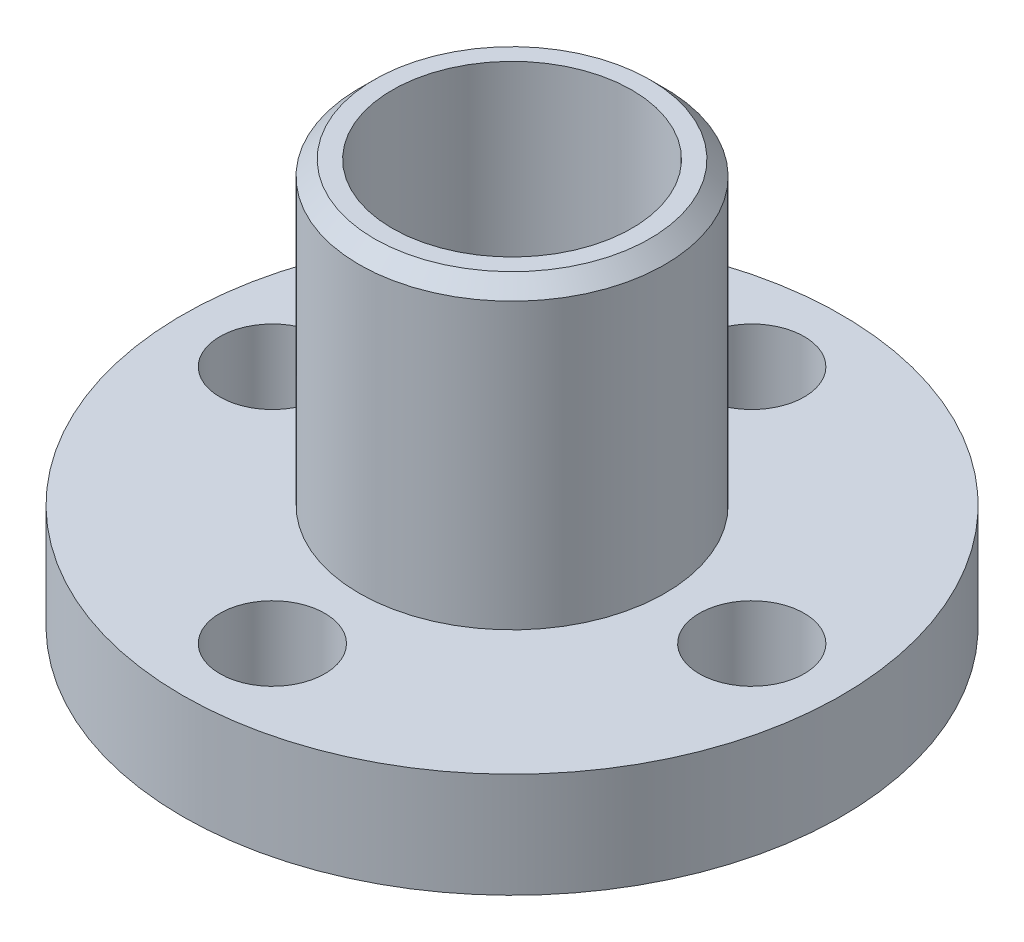
from build123d import *

# Parameters (mm, degrees)
SKETCH_1_R          = 11
EXTRUDE_1_DEPTH     = 3.5
SKETCH_2_R          = 4
CUT_EXTRUDE_1_DEPTH = 16.945218719
EXTRUDE_START       = 10
SKETCH_3_R          = 5.1
SKETCH_3_R_2        = 4
EXTRUDE_2_DEPTH     = 10
SKETCH_6_R          = 5.1
SKETCH_6_R_2        = 4
EXTRUDE_3_DEPTH     = 1.5
SKETCH_7_R          = 1.75
CUT_EXTRUDE_2_DEPTH = 19.493242009
CHAMFER_1_SIZE      = 0.5


with BuildPart() as part:
    # 草图1 → 凸台-拉伸1 (new body)
    with BuildSketch(Plane(origin=(0, 0, 0), x_dir=(1, 0, 0), z_dir=(0, 1, 0))):
        with Locations(Location((0, 0, 0), (0, 0, 270))):
            Circle(SKETCH_1_R)
    extrude(amount=EXTRUDE_1_DEPTH)

    # 草图2 → 切除-拉伸1 (cut, through all)
    with BuildSketch(Plane(origin=(0, 3.5, 0), x_dir=(1, 0, 0), z_dir=(0, 1, 0))):
        with Locations(Location((0, 0, 0), (0, 0, 270))):
            Circle(SKETCH_2_R)
    extrude(amount=-CUT_EXTRUDE_1_DEPTH, mode=Mode.SUBTRACT)

    # 草图3 → 凸台-拉伸2 (add)
    with BuildSketch(Plane(origin=(0, 3.5, 0), x_dir=(1, 0, 0), z_dir=(0, 1, 0)).offset(EXTRUDE_START)):
        with Locations(Location((0, 0, 0), (0, 0, 270))):
            Circle(SKETCH_3_R)
        with Locations(Location((0, 0, 0), (0, 0, 270))):
            Circle(SKETCH_3_R_2, mode=Mode.SUBTRACT)
    extrude(amount=-EXTRUDE_2_DEPTH)

    # 草图6 → 凸台-拉伸3 (add)
    with BuildSketch(Plane.XZ):
        with Locations(Location((0, 0, 0), (0, 0, 90))):
            Circle(SKETCH_6_R)
        with Locations(Location((0, 0, 0), (0, 0, 90))):
            Circle(SKETCH_6_R_2, mode=Mode.SUBTRACT)
    extrude(amount=EXTRUDE_3_DEPTH)

    # 草图7 → 切除-拉伸2 (cut, through all)
    with BuildSketch(Plane(origin=(0, 3.5, 0), x_dir=(1, 0, 0), z_dir=(0, 1, 0))):
        with Locations(Location((0, 8, 0), (0, 0, 270))):
            Circle(SKETCH_7_R)
        with Locations(Location((8, 0, 0), (0, 0, 270))):
            Circle(SKETCH_7_R)
        with Locations(Location((0, -8, 0), (0, 0, 270))):
            Circle(SKETCH_7_R)
        with Locations(Location((-8, 0, 0), (0, 0, 270))):
            Circle(SKETCH_7_R)
    extrude(amount=-CUT_EXTRUDE_2_DEPTH, mode=Mode.SUBTRACT)

    # 倒角1
    chamfer_1_edges = [part.edges().sort_by_distance(p)[0] for p in [
        (0, 13.5, -5.1),
        (0, -1.5, -5.1),
    ]]
    chamfer(chamfer_1_edges, length=CHAMFER_1_SIZE)


solid = part.part
